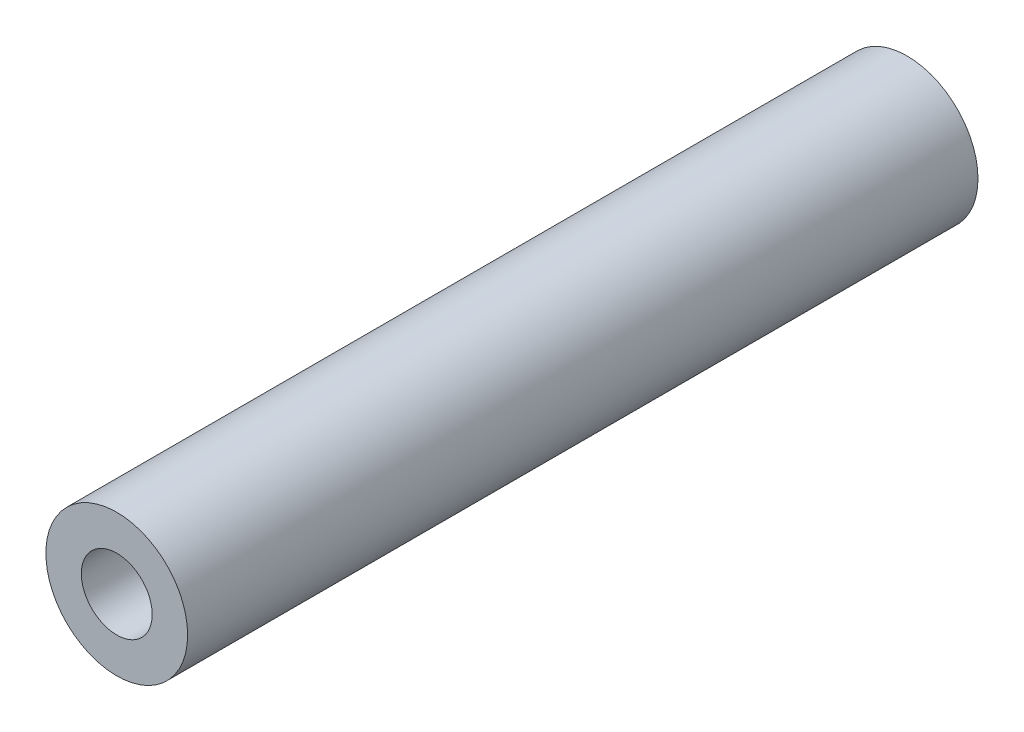
from build123d import *

# Parameters (mm, degrees)
SKETCH1_R           = 4
SKETCH1_R_2         = 2
BOSS_EXTRUDE1_DEPTH = 44.6


with BuildPart() as part:
    # Sketch1 → Boss-Extrude1 (new body)
    with BuildSketch(Plane.XY):
        Circle(SKETCH1_R)
        Circle(SKETCH1_R_2, mode=Mode.SUBTRACT)
    extrude(amount=BOSS_EXTRUDE1_DEPTH)


solid = part.part
